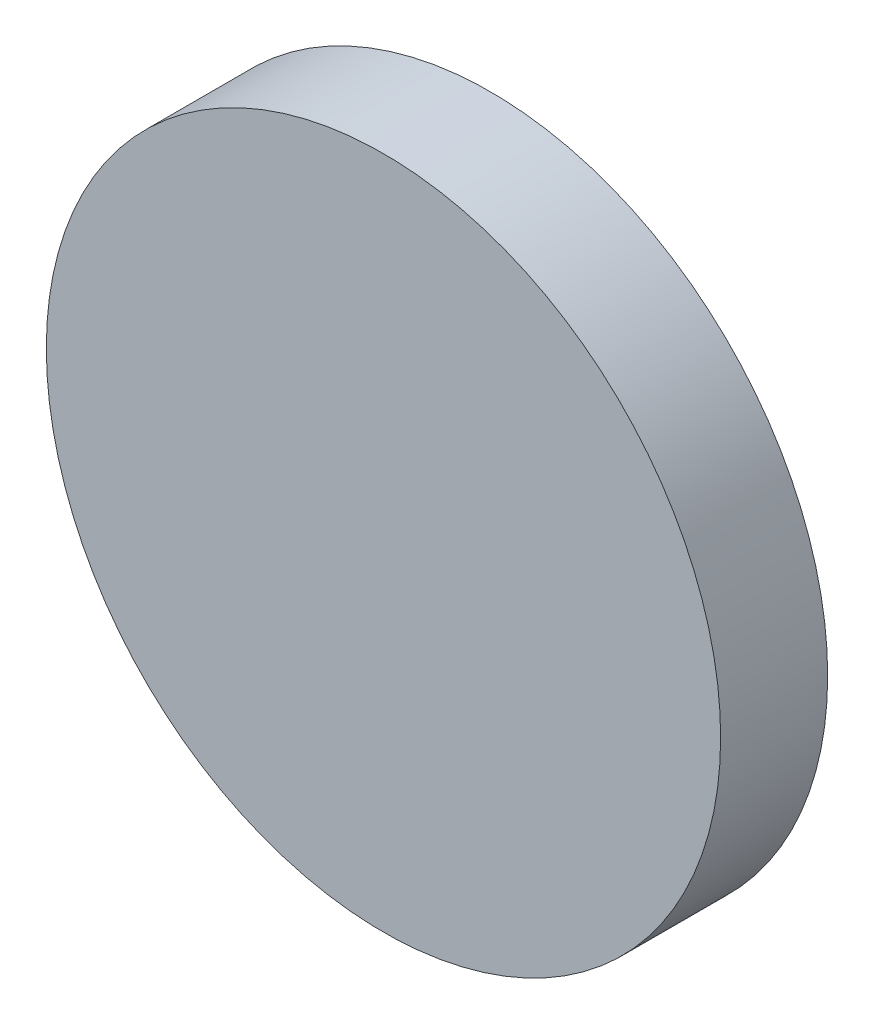
from build123d import *

# Parameters (mm, degrees)
SKETCH1_R           = 6.3
BOSS_EXTRUDE1_DEPTH = 2


with BuildPart() as part:
    # Sketch1 → Boss-Extrude1 (new body)
    with BuildSketch(Plane.XY):
        with Locations((93, -34.1)):
            Circle(SKETCH1_R)
    extrude(amount=-BOSS_EXTRUDE1_DEPTH)


solid = part.part
